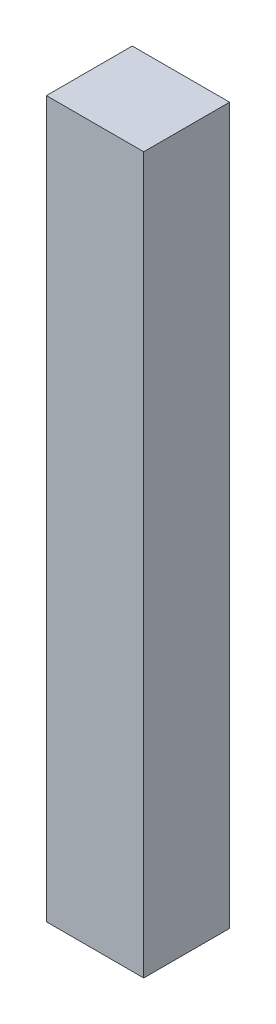
from build123d import *

# Parameters (mm, degrees)
SKETCH1_W           = 3.4
SKETCH1_H           = 25
BOSS_EXTRUDE1_DEPTH = 3


with BuildPart() as part:
    # Sketch1 → Boss-Extrude1 (new body)
    with BuildSketch(Plane.XY):
        Rectangle(SKETCH1_W, SKETCH1_H)
    extrude(amount=BOSS_EXTRUDE1_DEPTH)


solid = part.part
